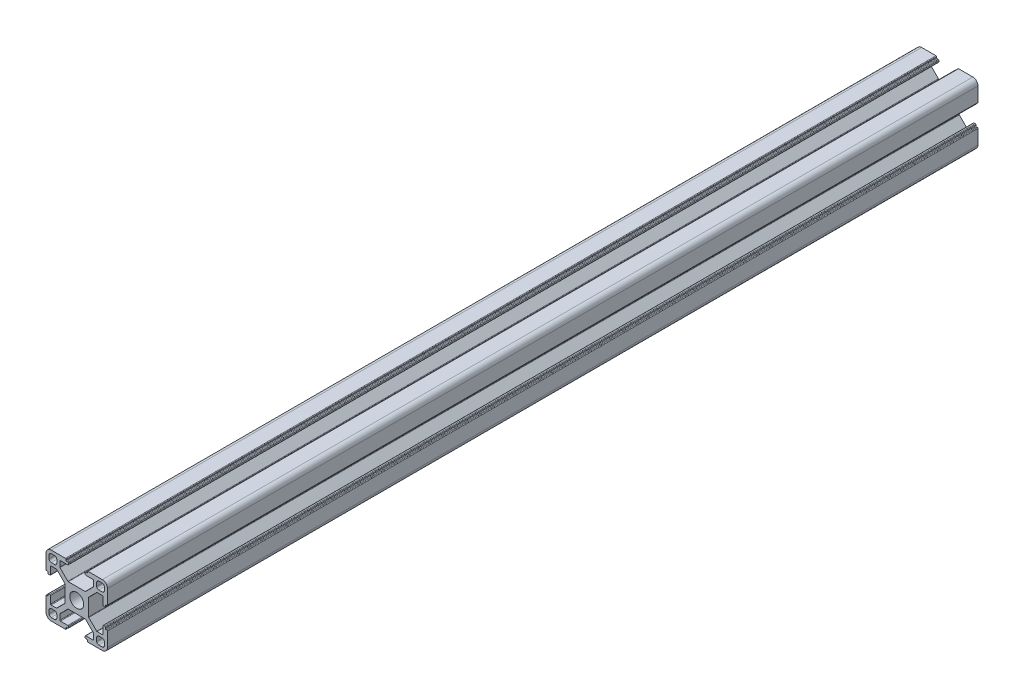
from build123d import *

# Parameters (mm, degrees)
MODEL_R             = 6.8
BOSS_EXTRUDE1_DEPTH = 850
SCALE1_SCALE        = 0.5


with BuildPart() as part:
    # Model → Boss-Extrude1 (new body)
    with BuildSketch(Plane.XY):
        with BuildLine():
            Line((0, 11.6), (-8.240202025, 11.6))
            ThreePointArc((-8.240202025, 11.6), (-8.469812085, 11.64567228), (-8.664466094, 11.775735931))
            Line((-8.664466094, 11.775735931), (-16.324264069, 19.435533906))
            ThreePointArc((-16.324264069, 19.435533906), (-16.45432772, 19.630187915), (-16.5, 19.859797975))
            Line((-16.5, 19.859797975), (-16.5, 25))
            ThreePointArc((-16.5, 25), (-16.324264069, 25.424264069), (-15.9, 25.6))
            Line((-15.9, 25.6), (-8.8, 25.6))
            ThreePointArc((-8.8, 25.6), (-8.375735931, 25.775735931), (-8.2, 26.2))
            Line((-8.2, 26.2), (-8.2, 27.4))
            ThreePointArc((-8.2, 27.4), (-8.375735931, 27.824264069), (-8.8, 28))
            Line((-8.8, 28), (-9.8, 28))
            ThreePointArc((-9.8, 28), (-10.224264069, 28.175735931), (-10.4, 28.6))
            Line((-10.4, 28.6), (-10.4, 29.4))
            ThreePointArc((-10.4, 29.4), (-10.575735931, 29.824264069), (-10.999999999, 30))
            Line((-10.999999999, 30), (-25, 30))
            ThreePointArc((-25, 30), (-28.535533906, 28.535533906), (-30, 25))
            Line((-30, 25), (-30, 11))
            ThreePointArc((-30, 11), (-29.824264069, 10.575735931), (-29.4, 10.4))
            Line((-29.4, 10.4), (-28.6, 10.4))
            ThreePointArc((-28.6, 10.4), (-28.175735931, 10.224264069), (-28, 9.8))
            Line((-28, 9.8), (-28, 8.8))
            ThreePointArc((-28, 8.8), (-27.824264069, 8.375735931), (-27.4, 8.2))
            Line((-27.4, 8.2), (-26.2, 8.2))
            ThreePointArc((-26.2, 8.2), (-25.775735931, 8.375735931), (-25.6, 8.8))
            Line((-25.6, 8.8), (-25.6, 15.9))
            ThreePointArc((-25.6, 15.9), (-25.424264069, 16.324264069), (-25, 16.5))
            Line((-25, 16.5), (-19.859797974, 16.5))
            ThreePointArc((-19.859797974, 16.5), (-19.630187915, 16.454327719), (-19.435533906, 16.324264068))
            Line((-19.435533906, 16.324264068), (-11.775735931, 8.664466094))
            ThreePointArc((-11.775735931, 8.664466094), (-11.64567228, 8.469812085), (-11.6, 8.240202025))
            Line((-11.6, 8.240202025), (-11.6, 0))
            Line((-11.6, 0), (-11.6, -8.240202025))
            ThreePointArc((-11.6, -8.240202025), (-11.64567228, -8.469812085), (-11.775735931, -8.664466094))
            Line((-11.775735931, -8.664466094), (-19.435533906, -16.324264068))
            ThreePointArc((-19.435533906, -16.324264068), (-19.630187915, -16.454327719), (-19.859797974, -16.5))
            Line((-19.859797974, -16.5), (-25, -16.5))
            ThreePointArc((-25, -16.5), (-25.424264069, -16.324264069), (-25.6, -15.9))
            Line((-25.6, -15.9), (-25.6, -8.8))
            ThreePointArc((-25.6, -8.8), (-25.775735931, -8.375735931), (-26.2, -8.2))
            Line((-26.2, -8.2), (-27.4, -8.2))
            ThreePointArc((-27.4, -8.2), (-27.824264069, -8.375735931), (-28, -8.8))
            Line((-28, -8.8), (-28, -9.8))
            ThreePointArc((-28, -9.8), (-28.175735931, -10.224264069), (-28.6, -10.4))
            Line((-28.6, -10.4), (-29.4, -10.4))
            ThreePointArc((-29.4, -10.4), (-29.824264069, -10.575735931), (-30, -11))
            Line((-30, -11), (-30, -25))
            ThreePointArc((-30, -25), (-28.535533906, -28.535533906), (-25, -30))
            Line((-25, -30), (-10.999999999, -30))
            ThreePointArc((-10.999999999, -30), (-10.575735931, -29.824264069), (-10.4, -29.4))
            Line((-10.4, -29.4), (-10.4, -28.6))
            ThreePointArc((-10.4, -28.6), (-10.224264069, -28.175735931), (-9.8, -28))
            Line((-9.8, -28), (-8.8, -28))
            ThreePointArc((-8.8, -28), (-8.375735931, -27.824264069), (-8.2, -27.4))
            Line((-8.2, -27.4), (-8.2, -26.2))
            ThreePointArc((-8.2, -26.2), (-8.375735931, -25.775735931), (-8.8, -25.6))
            Line((-8.8, -25.6), (-15.9, -25.6))
            ThreePointArc((-15.9, -25.6), (-16.324264069, -25.424264069), (-16.5, -25))
            Line((-16.5, -25), (-16.5, -19.859797975))
            ThreePointArc((-16.5, -19.859797975), (-16.45432772, -19.630187915), (-16.324264069, -19.435533906))
            Line((-16.324264069, -19.435533906), (-8.664466094, -11.775735931))
            ThreePointArc((-8.664466094, -11.775735931), (-8.469812085, -11.64567228), (-8.240202025, -11.6))
            Line((-8.240202025, -11.6), (0, -11.6))
            Line((0, -11.6), (8.240202025, -11.6))
            ThreePointArc((8.240202025, -11.6), (8.469812085, -11.64567228), (8.664466094, -11.775735931))
            Line((8.664466094, -11.775735931), (16.324264069, -19.435533906))
            ThreePointArc((16.324264069, -19.435533906), (16.45432772, -19.630187915), (16.5, -19.859797975))
            Line((16.5, -19.859797975), (16.5, -25))
            ThreePointArc((16.5, -25), (16.324264069, -25.424264069), (15.9, -25.6))
            Line((15.9, -25.6), (8.8, -25.6))
            ThreePointArc((8.8, -25.6), (8.375735931, -25.775735931), (8.2, -26.2))
            Line((8.2, -26.2), (8.2, -27.4))
            ThreePointArc((8.2, -27.4), (8.375735931, -27.824264069), (8.8, -28))
            Line((8.8, -28), (9.8, -28))
            ThreePointArc((9.8, -28), (10.224264069, -28.175735931), (10.4, -28.6))
            Line((10.4, -28.6), (10.4, -29.4))
            ThreePointArc((10.4, -29.4), (10.575735931, -29.824264069), (10.999999999, -30))
            Line((10.999999999, -30), (25, -30))
            ThreePointArc((25, -30), (28.535533906, -28.535533906), (30, -25))
            Line((30, -25), (30, -11))
            ThreePointArc((30, -11), (29.824264069, -10.575735931), (29.4, -10.4))
            Line((29.4, -10.4), (28.6, -10.4))
            ThreePointArc((28.6, -10.4), (28.175735931, -10.224264069), (28, -9.8))
            Line((28, -9.8), (28, -8.8))
            ThreePointArc((28, -8.8), (27.824264069, -8.375735931), (27.4, -8.2))
            Line((27.4, -8.2), (26.2, -8.2))
            ThreePointArc((26.2, -8.2), (25.775735931, -8.375735931), (25.6, -8.8))
            Line((25.6, -8.8), (25.6, -15.9))
            ThreePointArc((25.6, -15.9), (25.424264069, -16.324264069), (25, -16.5))
            Line((25, -16.5), (19.859797974, -16.5))
            ThreePointArc((19.859797974, -16.5), (19.630187915, -16.454327719), (19.435533906, -16.324264068))
            Line((19.435533906, -16.324264068), (11.775735931, -8.664466094))
            ThreePointArc((11.775735931, -8.664466094), (11.64567228, -8.469812085), (11.6, -8.240202025))
            Line((11.6, -8.240202025), (11.6, 0))
            Line((11.6, 0), (11.6, 8.240202025))
            ThreePointArc((11.6, 8.240202025), (11.64567228, 8.469812085), (11.775735931, 8.664466094))
            Line((11.775735931, 8.664466094), (19.611269837, 16.5))
            Line((19.611269837, 16.5), (25, 16.5))
            ThreePointArc((25, 16.5), (25.424264069, 16.324264069), (25.6, 15.9))
            Line((25.6, 15.9), (25.6, 8.8))
            ThreePointArc((25.6, 8.8), (25.775735931, 8.375735931), (26.2, 8.2))
            Line((26.2, 8.2), (27.4, 8.2))
            ThreePointArc((27.4, 8.2), (27.824264069, 8.375735931), (28, 8.8))
            Line((28, 8.8), (28, 9.8))
            ThreePointArc((28, 9.8), (28.175735931, 10.224264069), (28.6, 10.4))
            Line((28.6, 10.4), (29.4, 10.4))
            ThreePointArc((29.4, 10.4), (29.824264069, 10.575735931), (30, 11))
            Line((30, 11), (30, 25))
            ThreePointArc((30, 25), (28.535533906, 28.535533906), (25, 30))
            Line((25, 30), (10.999999999, 30))
            ThreePointArc((10.999999999, 30), (10.575735931, 29.824264069), (10.4, 29.4))
            Line((10.4, 29.4), (10.4, 28.6))
            ThreePointArc((10.4, 28.6), (10.224264069, 28.175735931), (9.8, 28))
            Line((9.8, 28), (8.8, 28))
            ThreePointArc((8.8, 28), (8.375735931, 27.824264069), (8.2, 27.4))
            Line((8.2, 27.4), (8.2, 26.2))
            ThreePointArc((8.2, 26.2), (8.375735931, 25.775735931), (8.8, 25.6))
            Line((8.8, 25.6), (15.9, 25.6))
            ThreePointArc((15.9, 25.6), (16.324264069, 25.424264069), (16.5, 25))
            Line((16.5, 25), (16.5, 19.859797975))
            ThreePointArc((16.5, 19.859797975), (16.45432772, 19.630187915), (16.324264069, 19.435533906))
            Line((16.324264069, 19.435533906), (8.664466094, 11.775735931))
            ThreePointArc((8.664466094, 11.775735931), (8.469812085, 11.64567228), (8.240202025, 11.6))
            Line((8.240202025, 11.6), (0, 11.6))
        make_face()
        Circle(MODEL_R, mode=Mode.SUBTRACT)
        with BuildLine():
            Line((21.5, 27), (25, 27))
            ThreePointArc((25, 27), (26.414213562, 26.414213562), (27, 25))
            Line((27, 25), (27, 21.5))
            ThreePointArc((27, 21.5), (26.414213562, 20.085786438), (25, 19.5))
            Line((25, 19.5), (21.5, 19.5))
            ThreePointArc((21.5, 19.5), (20.085786438, 20.085786438), (19.5, 21.5))
            Line((19.5, 21.5), (19.5, 25))
            ThreePointArc((19.5, 25), (20.085786438, 26.414213562), (21.5, 27))
        make_face(mode=Mode.SUBTRACT)
        with BuildLine():
            Line((21.5, -27), (25, -27))
            ThreePointArc((25, -27), (26.414213562, -26.414213562), (27, -25))
            Line((27, -25), (27, -21.5))
            ThreePointArc((27, -21.5), (26.414213562, -20.085786438), (25, -19.5))
            Line((25, -19.5), (21.5, -19.5))
            ThreePointArc((21.5, -19.5), (20.085786438, -20.085786438), (19.5, -21.5))
            Line((19.5, -21.5), (19.5, -25))
            ThreePointArc((19.5, -25), (20.085786438, -26.414213562), (21.5, -27))
        make_face(mode=Mode.SUBTRACT)
        with BuildLine():
            Line((-21.5, -27), (-25, -27))
            ThreePointArc((-25, -27), (-26.414213562, -26.414213562), (-27, -25))
            Line((-27, -25), (-27, -21.5))
            ThreePointArc((-27, -21.5), (-26.414213562, -20.085786438), (-25, -19.5))
            Line((-25, -19.5), (-21.5, -19.5))
            ThreePointArc((-21.5, -19.5), (-20.085786438, -20.085786438), (-19.5, -21.5))
            Line((-19.5, -21.5), (-19.5, -25))
            ThreePointArc((-19.5, -25), (-20.085786438, -26.414213562), (-21.5, -27))
        make_face(mode=Mode.SUBTRACT)
        with BuildLine():
            Line((-21.5, 27), (-25, 27))
            ThreePointArc((-25, 27), (-26.414213562, 26.414213562), (-27, 25))
            Line((-27, 25), (-27, 21.5))
            ThreePointArc((-27, 21.5), (-26.414213562, 20.085786438), (-25, 19.5))
            Line((-25, 19.5), (-21.5, 19.5))
            ThreePointArc((-21.5, 19.5), (-20.085786438, 20.085786438), (-19.5, 21.5))
            Line((-19.5, 21.5), (-19.5, 25))
            ThreePointArc((-19.5, 25), (-20.085786438, 26.414213562), (-21.5, 27))
        make_face(mode=Mode.SUBTRACT)
    extrude(amount=BOSS_EXTRUDE1_DEPTH)


with BuildPart() as part_1:
    # Scale1: scaled about (-0.000116359, -9.761e-05, 425)
    add(part.part.scale(SCALE1_SCALE).moved(Location((-5.818e-05, -4.8805e-05, 212.5))))


solid = part_1.part
